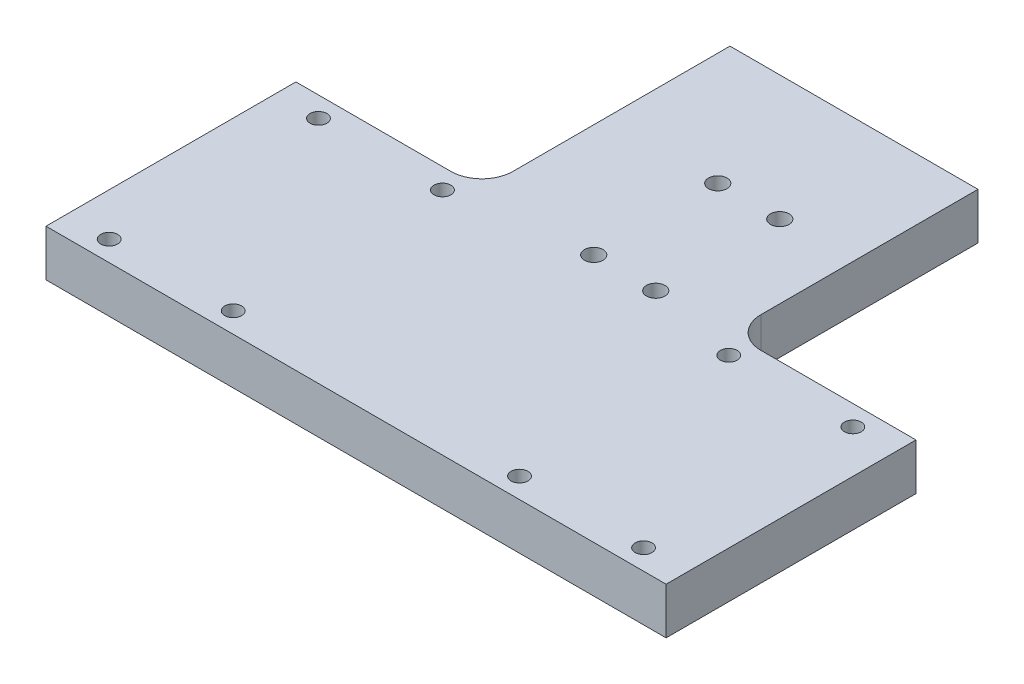
from build123d import *

# Parameters (mm, degrees)
BOSS_EXTRUDE1_DEPTH         = 9.525
F_8_32_TAPPED_HOLE1_D       = 3.4544
F_10_24_TAPPED_HOLE1_D      = 3.7973
F_1_4_20_TAPPED_HOLE1_D     = 5.1054
F_1_4_20_TAPPED_HOLE1_DEPTH = 19.05
F_1_4_20_TAPPED_HOLE1_TIP   = 1.533816902
FILLET1_R                   = 6.35


with BuildPart() as part:
    # Sketch1 → Boss-Extrude1 (new body)
    with BuildSketch(Plane(origin=(0, 0, 0), x_dir=(1, 0, 0), z_dir=(0, 1, 0))):
        Polygon((32.770273681, 9.766101756), (70.870273681, 9.766101756), (70.870273681, -41.414898244), (-56.129726319, -41.414898244), (-56.129726319, 9.766101756), (-18.029726319, 9.766101756), (-18.029726319, 60.566101756), (32.770273681, 60.566101756), align=None)
    extrude(amount=BOSS_EXTRUDE1_DEPTH)

    # #8-32 Tapped Hole1 (through all)
    with Locations(Plane(origin=(0, 9.525, 0), x_dir=(1, 0, 0), z_dir=(0, 1, 0))):
        with Locations((-47.354026319, 5.606851756), (-47.354026319, -37.255648244), (-21.954026319, -37.255648244), (-21.954026319, 5.606851756), (62.094573681, 5.606851756), (62.094573681, -37.255648244), (36.694573681, -37.255648244), (36.694573681, 5.606851756)):
            Hole(F_8_32_TAPPED_HOLE1_D / 2)

    # #10-24 Tapped Hole1 (through all)
    with Locations(Plane(origin=(0, 9.525, 0), x_dir=(1, 0, 0), z_dir=(0, 1, 0))):
        with Locations((5.058873681, 34.975601756), (17.758873681, 34.975601756), (5.058873681, 9.575601756), (17.758873681, 9.575601756)):
            Hole(F_10_24_TAPPED_HOLE1_D / 2)

    # 1/4-20 Tapped Hole1
    with Locations(Plane(origin=(0, 0, -60.566101756), x_dir=(-1, 0, 0), z_dir=(0, 0, -1))):
        with Locations((8.504726319, 4.7625), (-7.370273681, 4.7625), (-23.245273681, 4.7625)):
            Hole(F_1_4_20_TAPPED_HOLE1_D / 2, depth=F_1_4_20_TAPPED_HOLE1_DEPTH)
            with Locations((0, 0, -(F_1_4_20_TAPPED_HOLE1_DEPTH + F_1_4_20_TAPPED_HOLE1_TIP / 2))):  # 118° drill point
                Cone(0, F_1_4_20_TAPPED_HOLE1_D / 2, F_1_4_20_TAPPED_HOLE1_TIP, mode=Mode.SUBTRACT)

    # Fillet1
    fillet1_edges = [part.edges().sort_by_distance(p)[0] for p in [
        (32.770273681, 4.7625, -9.766101756),
        (-18.029726319, 4.7625, -9.766101756),
    ]]
    fillet(fillet1_edges, radius=FILLET1_R)


solid = part.part
